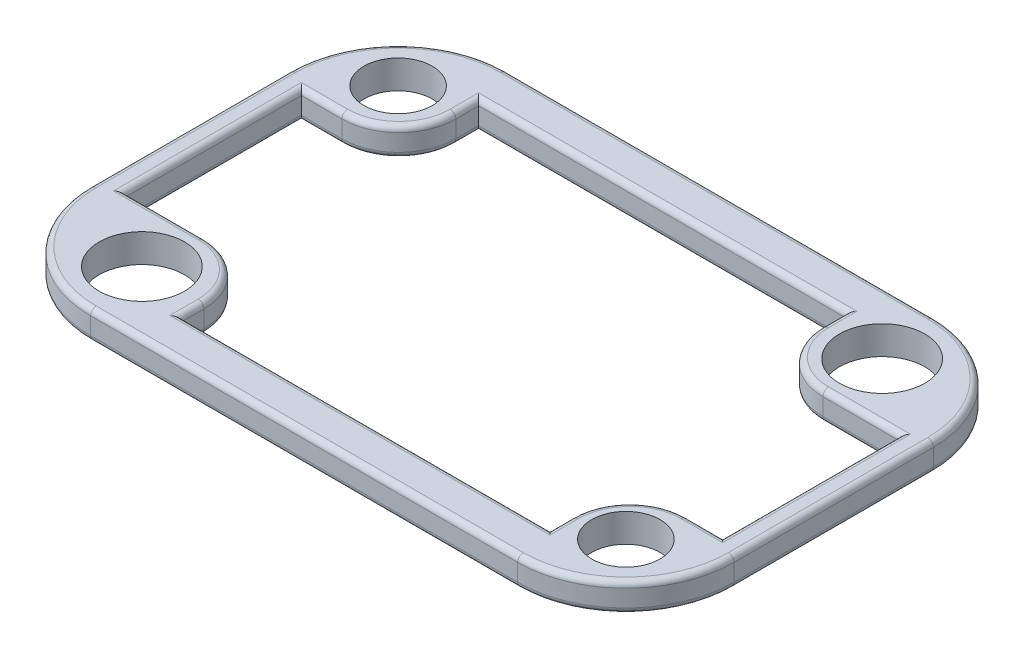
from build123d import *

# Parameters (mm, degrees)
SKETCH1_W           = 115
SKETCH1_H           = 75
SKETCH1_R           = 6
BOSS_EXTRUDE1_DEPTH = 5
CUT_EXTRUDE1_DEPTH  = 5
FILLET1_R           = 20
SKETCH5_R           = 7.5
CUT_EXTRUDE4_DEPTH  = 10
SKETCH9_W           = 57.70776026
SKETCH9_H           = 31
CUT_EXTRUDE5_DEPTH  = 10
FILLET2_R           = 10
CUT_EXTRUDE7_DEPTH  = 16
FILLET3_R           = 1


with BuildPart() as part:
    # Sketch1 → Boss-Extrude1 (new body)
    with BuildSketch(Plane(origin=(0, 0, 0), x_dir=(1, 0, 0), z_dir=(0, 1, 0))):
        Rectangle(SKETCH1_W, SKETCH1_H)
        with Locations(Location((-44.48, 24.48, 0), (0, 0, 270))):
            Circle(SKETCH1_R, mode=Mode.SUBTRACT)
        with Locations(Location((44.48, -24.48, 0), (0, 0, 270))):
            Circle(SKETCH1_R, mode=Mode.SUBTRACT)
    extrude(amount=BOSS_EXTRUDE1_DEPTH)

    # Sketch2 → Cut-Extrude1 (cut)
    with BuildSketch(Plane(origin=(0, 5, 0), x_dir=(1, 0, 0), z_dir=(0, 1, 0))):
        with BuildLine():
            Line((-41.5, 15.5), (41.5, 15.5))
            ThreePointArc((41.5, 15.5), (48.571067812, 12.571067812), (51.5, 5.5))
            Line((51.5, 5.5), (51.5, -5.5))
            ThreePointArc((51.5, -5.5), (48.571067812, -12.571067812), (41.5, -15.5))
            Line((41.5, -15.5), (-41.5, -15.5))
            ThreePointArc((-41.5, -15.5), (-48.571067812, -12.571067812), (-51.5, -5.5))
            Line((-51.5, -5.5), (-51.5, 5.5))
            ThreePointArc((-51.5, 5.5), (-48.571067812, 12.571067812), (-41.5, 15.5))
        make_face()
    extrude(amount=-CUT_EXTRUDE1_DEPTH, mode=Mode.SUBTRACT)

    # Fillet1
    fillet1_edges = [part.edges().sort_by_distance(p)[0] for p in [
        (57.5, 2.5, 37.5),
        (-57.5, 2.5, 37.5),
        (-57.5, 2.5, -37.5),
        (57.5, 2.5, -37.5),
    ]]
    fillet(fillet1_edges, radius=FILLET1_R)

    # Sketch5 → Cut-Extrude4 (cut)
    with BuildSketch(Plane.XZ):
        with Locations(Location((-39.5, 25.5, 0), (0, 0, 270))):
            Circle(SKETCH5_R)
        with Locations(Location((39.5, -25.5, 0), (0, 0, 270))):
            Circle(SKETCH5_R)
    extrude(amount=-CUT_EXTRUDE4_DEPTH, mode=Mode.SUBTRACT)

    # Sketch9 → Cut-Extrude5 (cut)
    with BuildSketch(Plane(origin=(0, 5, 0), x_dir=(1, 0, 0), z_dir=(0, 1, 0))):
        Polygon((-35.360842569, 29.5), (-35.360842569, 15.5), (-28.606695745, 15.5), (29.101064515, 15.5), (29.101064515, 29.5), align=None)
        Polygon((-28.606695745, 15.5), (-35.360842569, 15.5), (-52.5, 15.5), (-52.5, -15.5), (-28.606695745, -15.5), align=None)
        with Locations((0.247184385, 0)):
            Rectangle(SKETCH9_W, SKETCH9_H)
        Polygon((52.5, 15.5), (29.101064515, 15.5), (29.101064515, -15.5), (36.173307785, -15.5), (52.5, -15.5), align=None)
        Polygon((29.101064515, -15.5), (-28.606695745, -15.5), (-28.606695745, -29.5), (36.173307785, -29.5), (36.173307785, -15.5), align=None)
    extrude(amount=-CUT_EXTRUDE5_DEPTH, mode=Mode.SUBTRACT)

    # Fillet2
    fillet2_edges = [part.edges().sort_by_distance(p)[0] for p in [
        (-35.360842569, 2.5, -15.5),
        (29.101064515, 2.5, -15.5),
        (36.173307785, 2.5, 15.5),
        (-28.606695745, 2.5, 15.5),
    ]]
    fillet(fillet2_edges, radius=FILLET2_R)

    # Sketch11 → Cut-Extrude7 (cut)
    with BuildSketch(Plane(origin=(0, 5, 0), x_dir=(1, 0, 0), z_dir=(0, 1, 0))):
        with BuildLine():
            Line((57.5, -17.5), (57.5, 17.5))
            ThreePointArc((57.5, 17.5), (51.642135624, 31.642135624), (37.5, 37.5))
            Line((37.5, 37.5), (-37.5, 37.5))
            ThreePointArc((-37.5, 37.5), (-51.642135624, 31.642135624), (-57.5, 17.5))
            Line((-57.5, 17.5), (-57.5, -17.5))
            ThreePointArc((-57.5, -17.5), (-51.642135624, -31.642135624), (-37.5, -37.5))
            Line((-37.5, -37.5), (37.5, -37.5))
            ThreePointArc((37.5, -37.5), (51.642135624, -31.642135624), (57.5, -17.5))
        make_face()
        with BuildLine():
            Line((37.5, 36.5), (-37.5, 36.5))
            ThreePointArc((-37.5, 36.5), (-50.935028843, 30.935028843), (-56.5, 17.5))
            Line((-56.5, 17.5), (-56.5, -17.5))
            ThreePointArc((-56.5, -17.5), (-50.935028843, -30.935028843), (-37.5, -36.5))
            Line((-37.5, -36.5), (37.5, -36.5))
            ThreePointArc((37.5, -36.5), (50.935028843, -30.935028843), (56.5, -17.5))
            Line((56.5, -17.5), (56.5, 17.5))
            ThreePointArc((56.5, 17.5), (50.935028843, 30.935028843), (37.5, 36.5))
        make_face(mode=Mode.SUBTRACT)
    extrude(amount=-CUT_EXTRUDE7_DEPTH, mode=Mode.SUBTRACT)

    # Fillet3
    fillet3_edges = [part.edges().sort_by_distance(p)[0] for p in [
        (52.5, 5, 0),
        (3.78330602, 5, 29.5),
        (-52.5, 0, 0),
        (-3.129889027, 0, -29.5),
        (-3.129889027, 5, -29.5),
        (-52.5, 5, 0),
        (36.173307785, 0, 27.5),
        (36.173307785, 5, 27.5),
        (29.101064515, 0, -27.5),
        (-35.360842569, 0, -27.5),
        (-48.930421284, 0, -15.5),
        (-28.606695745, 0, 27.5),
        (49.336653893, 0, 15.5),
        (32.029996703, 0, -18.428932188),
        (-38.289774757, 0, -18.428932188),
        (-31.535627933, 0, 18.428932188),
        (39.102239973, 0, 18.428932188),
        (49.336653893, 5, 15.5),
        (29.101064515, 5, -27.5),
        (-28.606695745, 5, 27.5),
        (-48.930421284, 5, -15.5),
        (-35.360842569, 5, -27.5),
        (32.029996703, 5, -18.428932188),
        (-38.289774757, 5, -18.428932188),
        (-31.535627933, 5, 18.428932188),
        (39.102239973, 5, 18.428932188),
        (0, 0, -36.5),
        (-50.935028843, 0, -30.935028843),
        (-56.5, 0, 0),
        (-50.935028843, 0, 30.935028843),
        (0, 0, 36.5),
        (50.935028843, 0, 30.935028843),
        (56.5, 0, 0),
        (50.935028843, 0, -30.935028843),
        (50.935028843, 5, -30.935028843),
        (56.5, 5, 0),
        (50.935028843, 5, 30.935028843),
        (0, 5, 36.5),
        (-50.935028843, 5, 30.935028843),
        (-56.5, 5, 0),
        (-50.935028843, 5, -30.935028843),
        (0, 5, -36.5),
        (-45.553347872, 0, 15.5),
        (45.800532257, 0, -15.5),
        (45.800532257, 5, -15.5),
        (-45.553347872, 5, 15.5),
        (52.5, 0, 0),
        (3.78330602, 0, 29.5),
    ]]
    fillet(fillet3_edges, radius=FILLET3_R)


solid = part.part
